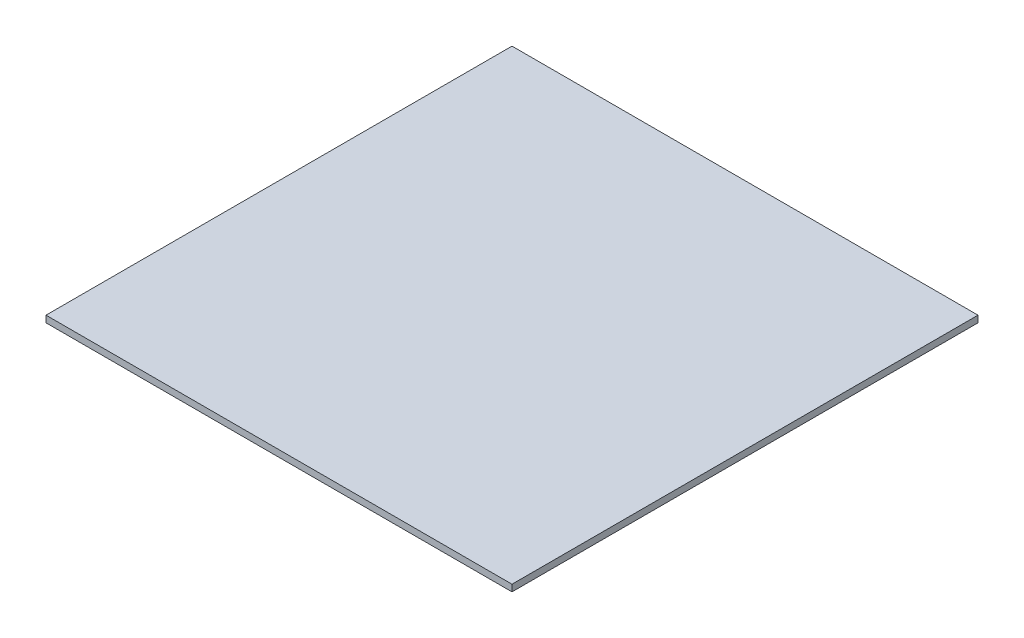
from build123d import *

# Parameters (mm, degrees)
SKETCH1_W           = 700
SKETCH1_H           = 700
BOSS_EXTRUDE1_DEPTH = 10


with BuildPart() as part:
    # Sketch1 → Boss-Extrude1 (new body)
    with BuildSketch(Plane(origin=(0, 0, 0), x_dir=(1, 0, 0), z_dir=(0, 1, 0))):
        Rectangle(SKETCH1_W, SKETCH1_H)
    extrude(amount=BOSS_EXTRUDE1_DEPTH)


solid = part.part
